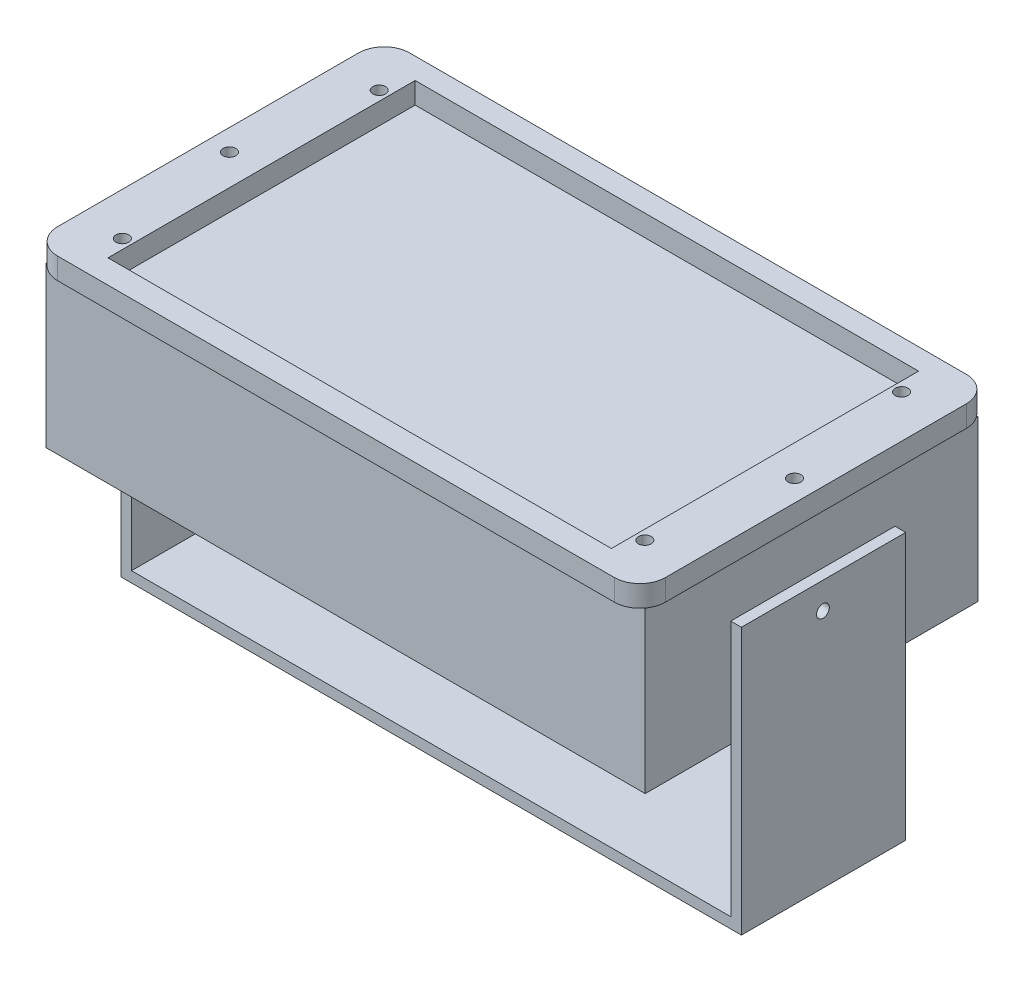
from build123d import *
from build123d.topology import SkipClean

# Parameters (mm, degrees)
SKETCH5_R           = 3
SKETCH5_W           = 236
SKETCH5_H           = 144
BOSS_EXTRUDE1_DEPTH = 10
BOSS_EXTRUDE2_START = 75
SKETCH7_W           = 280.9
SKETCH7_H           = 156
SKETCH7_R           = 3
BOSS_EXTRUDE2_DEPTH = 75
SKETCH9_W           = 5
SKETCH9_H           = 77
SKETCH9_W_2         = 280.9
BOSS_EXTRUDE3_DEPTH = 5
SKETCH10_W          = 5
SKETCH10_H          = 77
BOSS_EXTRUDE5_DEPTH = 120
SKETCH11_R          = 3
CUT_EXTRUDE1_DEPTH  = 1011


with BuildPart() as part:
    # Sketch5 → Boss-Extrude1 (new body)
    with BuildSketch(Plane(origin=(0, 0, 0), x_dir=(1, 0, 0), z_dir=(0, 1, 0))):
        with BuildLine():
            Line((-142.45, 69.9), (-142.45, -71.1))
            ThreePointArc((-142.45, -71.1), (-138.935281374, -79.585281374), (-130.45, -83.1))
            Line((-130.45, -83.1), (130.45, -83.1))
            ThreePointArc((130.45, -83.1), (138.935281374, -79.585281374), (142.45, -71.1))
            Line((142.45, -71.1), (142.45, 69.9))
            ThreePointArc((142.45, 69.9), (138.935281374, 78.385281374), (130.45, 81.9))
            Line((130.45, 81.9), (-130.45, 81.9))
            ThreePointArc((-130.45, 81.9), (-138.935281374, 78.385281374), (-142.45, 69.9))
        make_face()
        with Locations(Location((-122.45, 59.6, 0), (0, 0, 270))):
            Circle(SKETCH5_R, mode=Mode.SUBTRACT)
        with Locations(Location((-122.45, -60.8, 0), (0, 0, 270))):
            Circle(SKETCH5_R, mode=Mode.SUBTRACT)
        with Locations(Location((122.45, -60.8, 0), (0, 0, 270))):
            Circle(SKETCH5_R, mode=Mode.SUBTRACT)
        with Locations(Location((122.45, 59.6, 0), (0, 0, 270))):
            Circle(SKETCH5_R, mode=Mode.SUBTRACT)
        with Locations(Location((-132.45, -0.6, 0), (0, 0, 270))):
            Circle(SKETCH5_R, mode=Mode.SUBTRACT)
        with Locations(Location((132.45, -0.6, 0), (0, 0, 90))):
            Circle(SKETCH5_R, mode=Mode.SUBTRACT)
        Rectangle(SKETCH5_W, SKETCH5_H, mode=Mode.SUBTRACT)
    extrude(amount=BOSS_EXTRUDE1_DEPTH)

    # Sketch7 → Boss-Extrude2 (add)
    with SkipClean():  # the faces are left unmerged after this step: merging them gives an invalid solid
        with BuildSketch(Plane.XZ.offset(BOSS_EXTRUDE2_START)):
            with Locations((0, 0.6)):
                Rectangle(SKETCH7_W, SKETCH7_H)
            with Locations(Location((132.45, 0.6, 0), (0, 0, 270))):
                Circle(SKETCH7_R, mode=Mode.SUBTRACT)
            with Locations(Location((-132.45, 0.6, 0), (0, 0, 270))):
                Circle(SKETCH7_R, mode=Mode.SUBTRACT)
        extrude(amount=-BOSS_EXTRUDE2_DEPTH)



with BuildPart() as body_2:
    # Sketch9 → Boss-Extrude3 (new body)
    with BuildSketch(Plane(origin=(0, -145, 0), x_dir=(-1, 0, 0), z_dir=(0, -1, 0))):
        with Locations((-142.95, 0)):
            Rectangle(SKETCH9_W, SKETCH9_H)
        Rectangle(SKETCH9_W_2, SKETCH9_H)
        with Locations((142.95, 0)):
            Rectangle(SKETCH9_W, SKETCH9_H)
    extrude(amount=BOSS_EXTRUDE3_DEPTH)


with BuildPart() as part_1:
    with SkipClean():  # the faces are left unmerged after this step: merging them gives an invalid solid
        add(part.part)

        add(body_2.part)  # Boss-Extrude5 merges body 2
        # Sketch10 → Boss-Extrude5 (add)
        with BuildSketch(Plane(origin=(0, -145, 0), x_dir=(1, 0, 0), z_dir=(0, 1, 0))):
            with Locations((-142.95, 0)):
                Rectangle(SKETCH10_W, SKETCH10_H)
            with Locations((142.95, 0)):
                Rectangle(SKETCH10_W, SKETCH10_H)
        extrude(amount=BOSS_EXTRUDE5_DEPTH)

    # Sketch11 → Cut-Extrude1 (cut)
    with SkipClean():  # the faces are left unmerged after this step: merging them gives an invalid solid
        with BuildSketch(Plane.ZY.offset(145.45)):
            with Locations((0.3, -37.5)):
                Circle(SKETCH11_R)
        extrude(amount=-CUT_EXTRUDE1_DEPTH, mode=Mode.SUBTRACT)


solid = part_1.part
